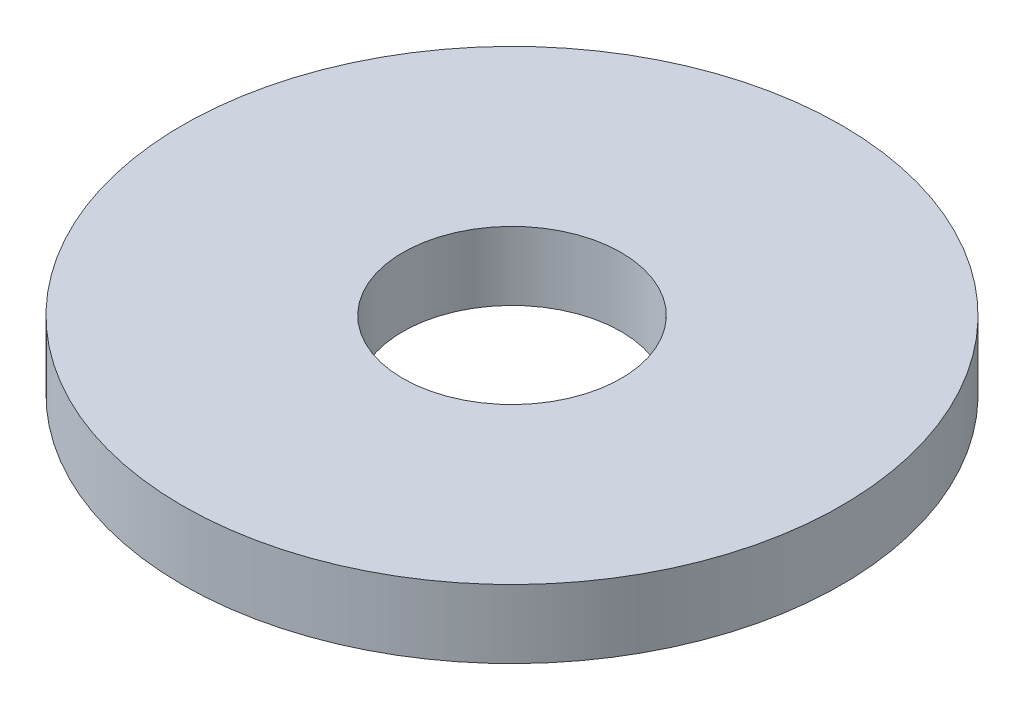
from build123d import *

# Parameters (mm, degrees)
CROQUIS2_R              = 9.779
CROQUIS2_R_2            = 3.2385
SALIENTE_EXTRUIR1_DEPTH = 2.032


with BuildPart() as part:
    # Croquis2 → Saliente-Extruir1 (new body)
    with BuildSketch(Plane(origin=(0, 0, 0), x_dir=(1, 0, 0), z_dir=(0, 1, 0))):
        with Locations(Location((0, 0, 0), (0, 0, 270))):
            Circle(CROQUIS2_R)
        with Locations(Location((0, 0, 0), (0, 0, 270))):
            Circle(CROQUIS2_R_2, mode=Mode.SUBTRACT)
    extrude(amount=SALIENTE_EXTRUIR1_DEPTH)


solid = part.part
